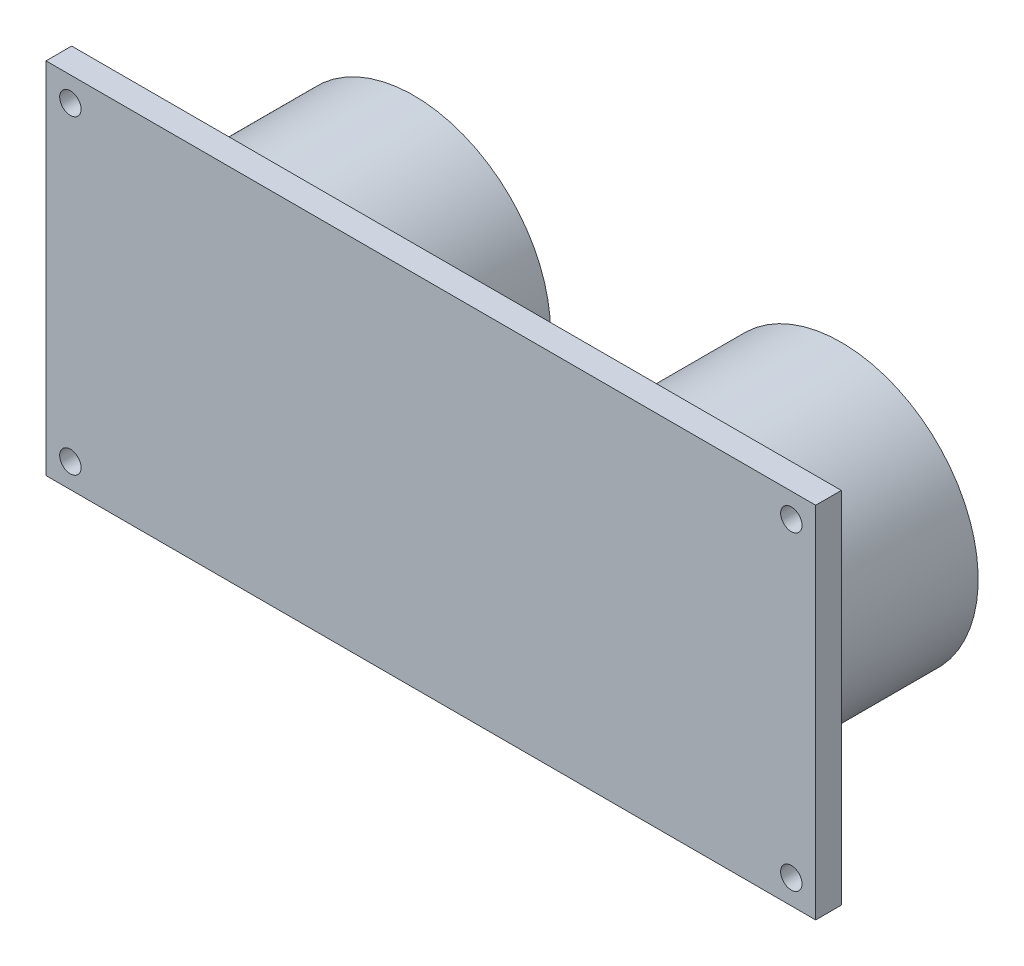
from build123d import *

# Parameters (mm, degrees)
CROQUIS1_W              = 45
CROQUIS1_H              = 21
CROQUIS1_R              = 0.625
SALIENTE_EXTRUIR1_DEPTH = 1.5
CROQUIS2_R              = 8
SALIENTE_EXTRUIR2_DEPTH = 10


with BuildPart() as part:
    # Croquis1 → Saliente-Extruir1 (new body)
    with BuildSketch(Plane.XY):
        with Locations((22.5, 10.5)):
            Rectangle(CROQUIS1_W, CROQUIS1_H)
        with Locations((1.425, 19.575)):
            Circle(CROQUIS1_R, mode=Mode.SUBTRACT)
        with Locations(Location((43.575, 19.575, 0), (0, 0, 180))):
            Circle(CROQUIS1_R, mode=Mode.SUBTRACT)
        with Locations((43.575, 1.425)):
            Circle(CROQUIS1_R, mode=Mode.SUBTRACT)
        with Locations(Location((1.425, 1.425, 0), (0, 0, 180))):
            Circle(CROQUIS1_R, mode=Mode.SUBTRACT)
    extrude(amount=SALIENTE_EXTRUIR1_DEPTH)

    # Croquis2 → Saliente-Extruir2 (add)
    with BuildSketch(Plane(origin=(0, 0, 0), x_dir=(-1, 0, 0), z_dir=(0, 0, -1))):
        with Locations((-35, 10.5)):
            Circle(CROQUIS2_R)
        with Locations(Location((-10, 10.5, 0), (0, 0, 180))):
            Circle(CROQUIS2_R)
    extrude(amount=SALIENTE_EXTRUIR2_DEPTH)


solid = part.part
